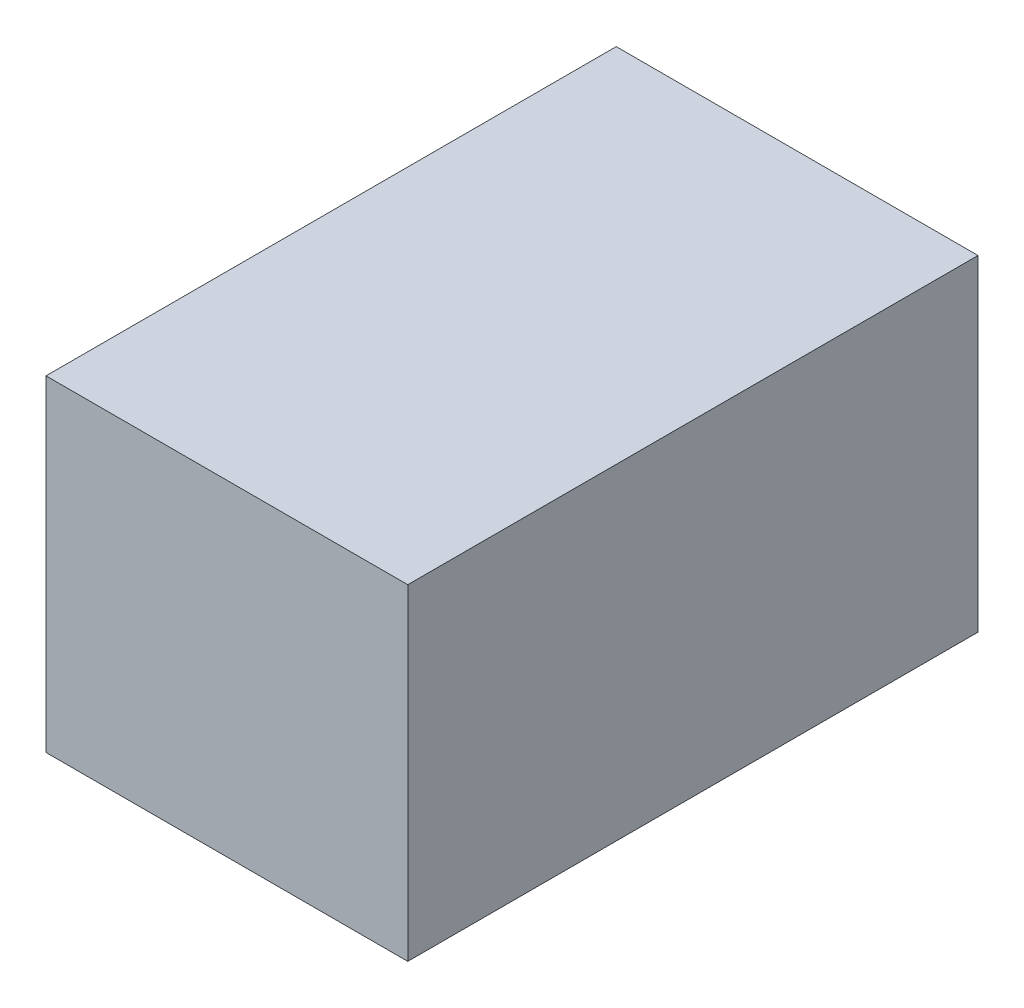
from build123d import *

# Parameters (mm, degrees)
SKETCH1_W           = 11.09
SKETCH1_H           = 17.48
BOSS_EXTRUDE1_DEPTH = 10


with BuildPart() as part:
    # Sketch1 → Boss-Extrude1 (new body)
    with BuildSketch(Plane(origin=(0, 0, 0), x_dir=(1, 0, 0), z_dir=(0, 1, 0))):
        with Locations((5.545, -8.74)):
            Rectangle(SKETCH1_W, SKETCH1_H)
    extrude(amount=BOSS_EXTRUDE1_DEPTH)


solid = part.part
